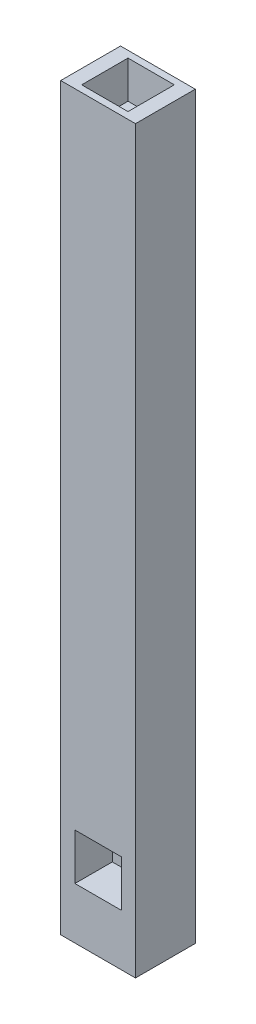
from build123d import *

# Parameters (mm, degrees)
SKETCH1_W           = 12.7
SKETCH1_H           = 125.73
BOSS_EXTRUDE1_DEPTH = 10.16
SKETCH4_W           = 7.874
SKETCH4_H           = 7.874
CUT_EXTRUDE2_DEPTH  = 6.35
SKETCH6_W           = 7.874
SKETCH6_H           = 7.874
CUT_EXTRUDE4_DEPTH  = 6.35
SKETCH8_W           = 7.874
SKETCH8_H           = 7.874
CUT_EXTRUDE5_DEPTH  = 6.35


with BuildPart() as part:
    # Sketch1 → Boss-Extrude1 (new body)
    with BuildSketch(Plane.XY):
        with Locations((0, 75.565)):
            Rectangle(SKETCH1_W, SKETCH1_H)
    extrude(amount=BOSS_EXTRUDE1_DEPTH)

    # Sketch4 → Cut-Extrude2 (cut)
    with BuildSketch(Plane(origin=(0, 138.43, 0), x_dir=(1, 0, 0), z_dir=(0, 1, 0))):
        with Locations((0, -5.08)):
            Rectangle(SKETCH4_W, SKETCH4_H)
    extrude(amount=-CUT_EXTRUDE2_DEPTH, mode=Mode.SUBTRACT)

    # Sketch6 → Cut-Extrude4 (cut)
    with BuildSketch(Plane.XY.offset(10.16)):
        with Locations((0, 25.4)):
            Rectangle(SKETCH6_W, SKETCH6_H)
    extrude(amount=-CUT_EXTRUDE4_DEPTH, mode=Mode.SUBTRACT)

    # Sketch8 → Cut-Extrude5 (cut)
    with BuildSketch(Plane.XZ.offset(-12.7)):
        with Locations((0, 5.08)):
            Rectangle(SKETCH8_W, SKETCH8_H)
    extrude(amount=-CUT_EXTRUDE5_DEPTH, mode=Mode.SUBTRACT)


solid = part.part
